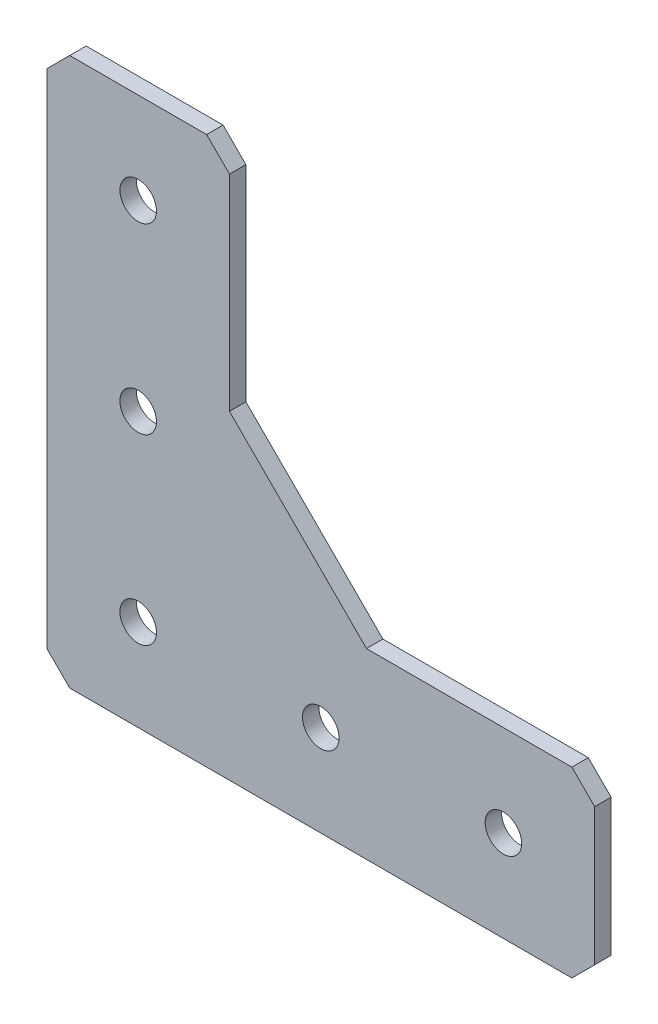
from build123d import *

# Parameters (mm, degrees)
SKETCH1_R           = 2.54
BOSS_EXTRUDE1_DEPTH = 2.286


with BuildPart() as part:
    # Sketch1 → Boss-Extrude1 (new body)
    with BuildSketch(Plane(origin=(0, 0, 0), x_dir=(-1, 0, 0), z_dir=(0, 0, -1))):
        Polygon((-73.025, 25.4), (-76.2, 22.225), (-76.2, 3.175), (-73.025, 0), (-3.175, 0), (0, 3.175), (0, 73.025), (-3.175, 76.2), (-22.225, 76.2), (-25.4, 73.025), (-25.4, 44.45), (-44.45, 25.4), align=None)
        with Locations(Location((-12.7, 12.7, 0), (0, 0, 180))):
            Circle(SKETCH1_R, mode=Mode.SUBTRACT)
        with Locations(Location((-12.7, 63.5, 0), (0, 0, 180))):
            Circle(SKETCH1_R, mode=Mode.SUBTRACT)
        with Locations(Location((-12.7, 38.1, 0), (0, 0, 180))):
            Circle(SKETCH1_R, mode=Mode.SUBTRACT)
        with Locations(Location((-63.5, 12.7, 0), (0, 0, 180))):
            Circle(SKETCH1_R, mode=Mode.SUBTRACT)
        with Locations(Location((-38.1, 12.7, 0), (0, 0, 180))):
            Circle(SKETCH1_R, mode=Mode.SUBTRACT)
    extrude(amount=-BOSS_EXTRUDE1_DEPTH)


solid = part.part
